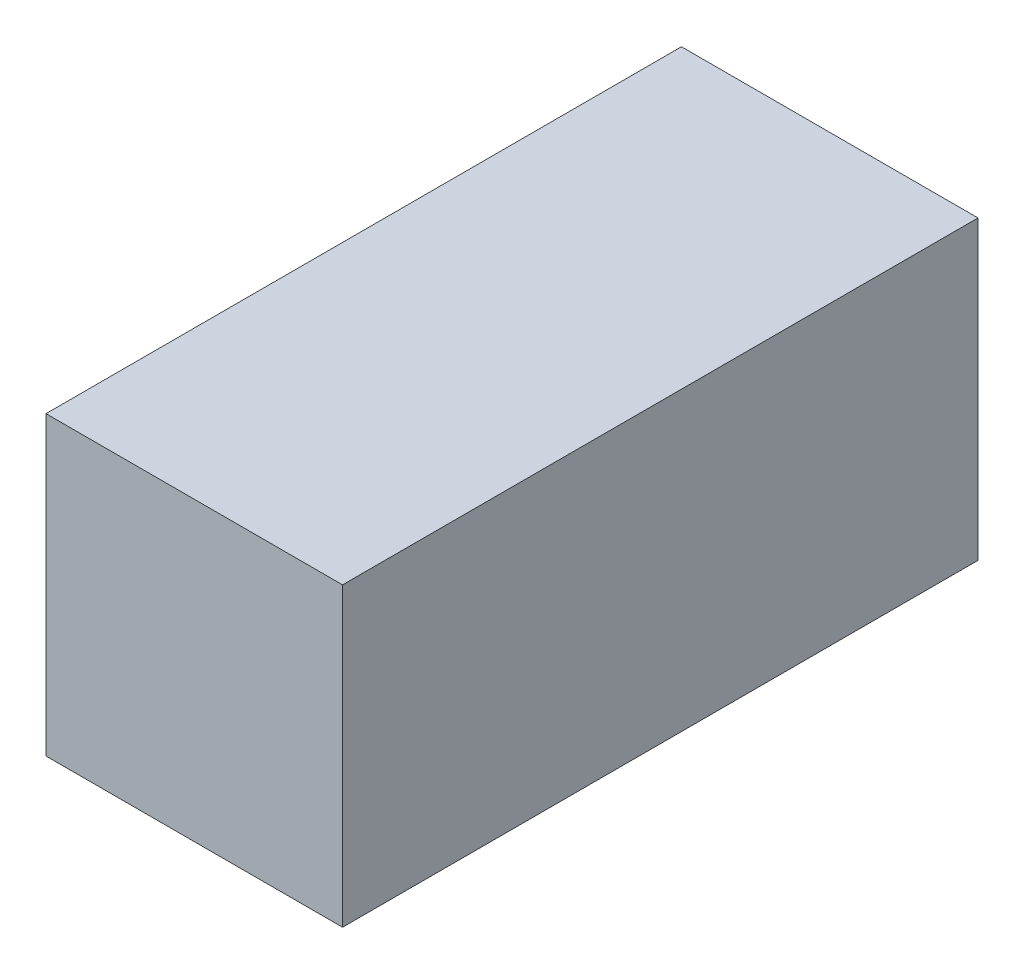
from build123d import *

# Parameters (mm, degrees)
SKETCH1_W           = 44.45
SKETCH1_H           = 44.45
BOSS_EXTRUDE1_DEPTH = 95.25


with BuildPart() as part:
    # Sketch1 → Boss-Extrude1 (new body)
    with BuildSketch(Plane.XY):
        Rectangle(SKETCH1_W, SKETCH1_H)
    extrude(amount=BOSS_EXTRUDE1_DEPTH)


solid = part.part
